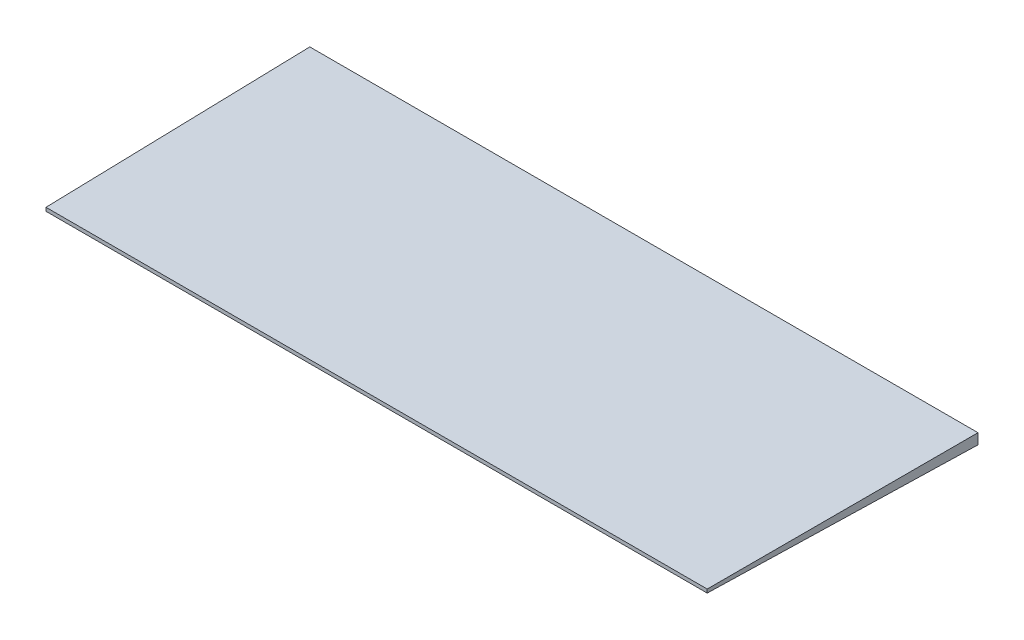
from build123d import *

# Parameters (mm, degrees)
SKETCH1_W           = 381
SKETCH1_H           = 6
BOSS_EXTRUDE1_DEPTH = 152.4
BOSS_EXTRUDE1_TAPER = 0.75


with BuildPart() as part:
    # Sketch1 → Boss-Extrude1 (new body)
    with BuildSketch(Plane.XY):
        Rectangle(SKETCH1_W, SKETCH1_H)
    extrude(amount=BOSS_EXTRUDE1_DEPTH, taper=BOSS_EXTRUDE1_TAPER)


solid = part.part
